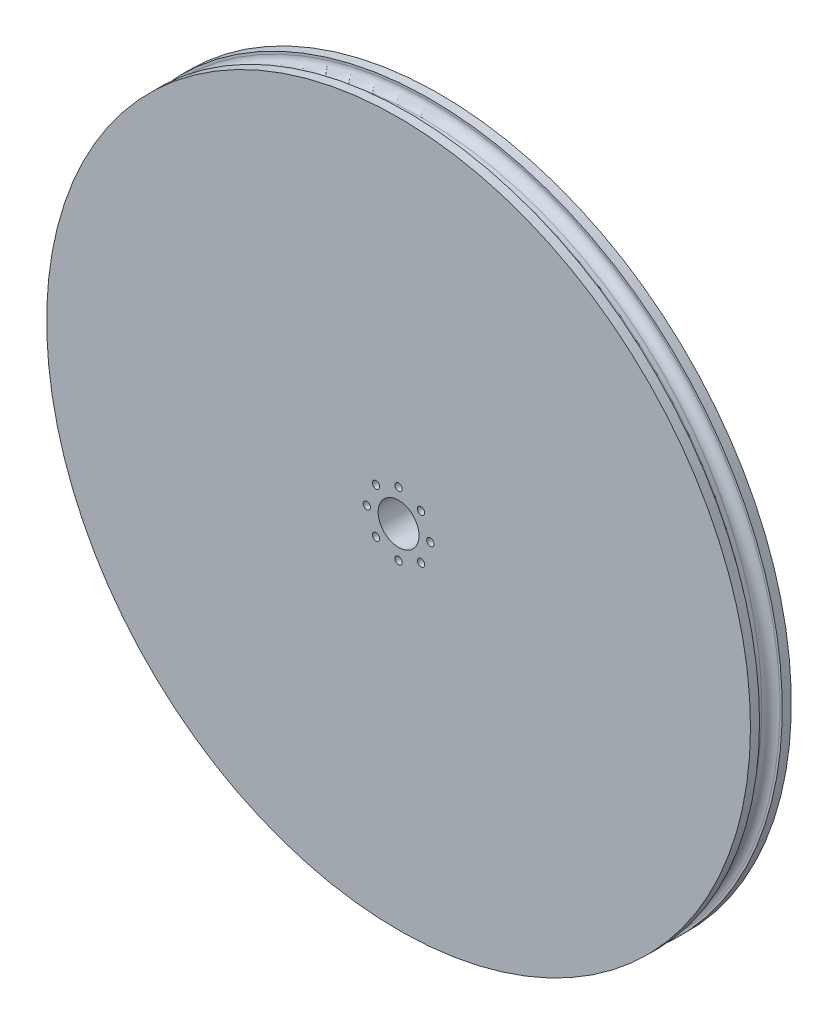
from build123d import *

# Parameters (mm, degrees)
SKETCH1_R           = 75
BOSS_EXTRUDE1_DEPTH = 5
SKETCH2_R           = 77.5
BOSS_EXTRUDE2_DEPTH = 2
BOSS_EXTRUDE3_START = 2
SKETCH3_R           = 77.5
BOSS_EXTRUDE3_DEPTH = 2
CUT_EXTRUDE2_DEPTH  = 110.970450577
SKETCH10_R          = 10
CUT_EXTRUDE3_DEPTH  = 2.5
FILLET1_R           = 2


with BuildPart() as part:
    # Sketch1 → Boss-Extrude1 (new body)
    with BuildSketch(Plane.XY):
        Circle(SKETCH1_R)
    extrude(amount=BOSS_EXTRUDE1_DEPTH)

    # Sketch2 → Boss-Extrude2 (add)
    with BuildSketch(Plane.XY.offset(5)):
        Circle(SKETCH2_R)
    extrude(amount=BOSS_EXTRUDE2_DEPTH)

    # Sketch3 → Boss-Extrude3 (add)
    with BuildSketch(Plane(origin=(0, 0, 0), x_dir=(-1, 0, 0), z_dir=(0, 0, -1)).offset(BOSS_EXTRUDE3_START)):
        with Locations(Location((0, 0, 0), (0, 0, 180))):
            Circle(SKETCH3_R)
    extrude(amount=-BOSS_EXTRUDE3_DEPTH)

    # Sketch5 → Cut-Extrude2 (cut, through all)
    with BuildSketch(Plane(origin=(0, 0, -2), x_dir=(-1, 0, 0), z_dir=(0, 0, -1))):
        with BuildLine():
            ThreePointArc((-4.5, 0), (0, -4.5), (4.5, 0))
            ThreePointArc((4.5, 0), (0, 4.5), (-4.5, 0))
        make_face()
        with BuildLine():
            ThreePointArc((-4.149747468, 4.949747468), (-4.949747468, 5.749747468), (-5.749747468, 4.949747468))
            ThreePointArc((-5.749747468, 4.949747468), (-4.949747468, 4.149747468), (-4.149747468, 4.949747468))
        make_face()
        with BuildLine():
            ThreePointArc((-6.2, 0), (-7, 0.8), (-7.8, 0))
            ThreePointArc((-7.8, 0), (-7, -0.8), (-6.2, 0))
        make_face()
        with BuildLine():
            ThreePointArc((-4.149747468, -4.949747468), (-4.949747468, -4.149747468), (-5.749747468, -4.949747468))
            ThreePointArc((-5.749747468, -4.949747468), (-4.949747468, -5.749747468), (-4.149747468, -4.949747468))
        make_face()
        with BuildLine():
            ThreePointArc((-0.8, -7), (0, -7.8), (0.8, -7))
            ThreePointArc((0.8, -7), (0, -6.2), (-0.8, -7))
        make_face()
        with BuildLine():
            ThreePointArc((4.149747468, -4.949747468), (4.949747468, -5.749747468), (5.749747468, -4.949747468))
            ThreePointArc((5.749747468, -4.949747468), (4.949747468, -4.149747468), (4.149747468, -4.949747468))
        make_face()
        with BuildLine():
            ThreePointArc((6.2, 0), (7, -0.8), (7.8, 0))
            ThreePointArc((7.8, 0), (7, 0.8), (6.2, 0))
        make_face()
        with BuildLine():
            ThreePointArc((4.149747468, 4.949747468), (4.949747468, 4.149747468), (5.749747468, 4.949747468))
            ThreePointArc((5.749747468, 4.949747468), (4.949747468, 5.749747468), (4.149747468, 4.949747468))
        make_face()
        with BuildLine():
            ThreePointArc((0.8, 7), (0, 7.8), (-0.8, 7))
            ThreePointArc((-0.8, 7), (0, 6.2), (0.8, 7))
        make_face()
    extrude(amount=-CUT_EXTRUDE2_DEPTH, mode=Mode.SUBTRACT)

    # Sketch10 → Cut-Extrude3 (cut)
    with BuildSketch(Plane(origin=(0, 0, -2), x_dir=(-1, 0, 0), z_dir=(0, 0, -1))):
        Circle(SKETCH10_R)
    extrude(amount=-CUT_EXTRUDE3_DEPTH, mode=Mode.SUBTRACT)

    # Fillet1
    fillet1_edges = [part.edges().sort_by_distance(p)[0] for p in [
        (-75, 0, 5),
        (-75, 0, 0),
    ]]
    fillet(fillet1_edges, radius=FILLET1_R)


solid = part.part
